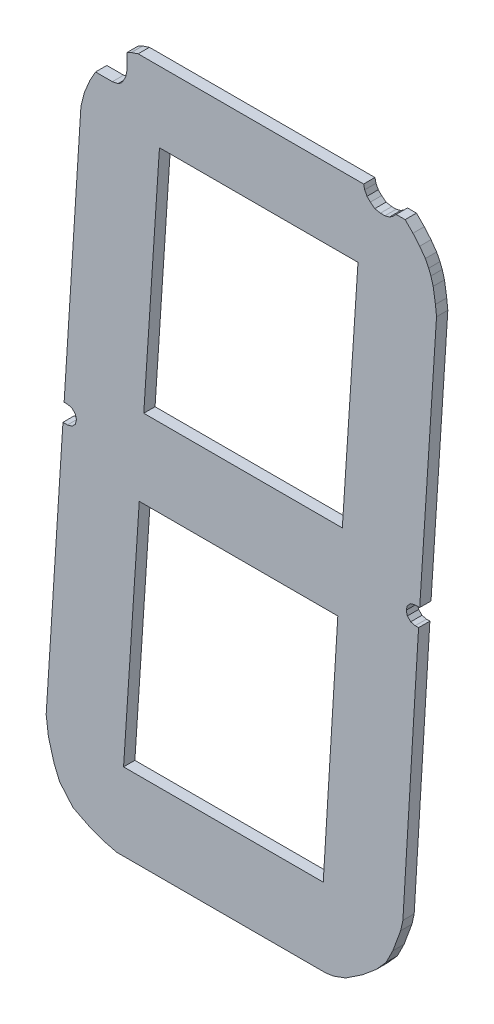
from build123d import *

# Parameters (mm, degrees)
AUFSATZ_LINEAR_AUSTRAGEN1_DEPTH = 1.6


with BuildPart() as part:
    # Skizze1 → Aufsatz-Linear austragen1 (new body)
    with BuildSketch(Plane.XY):
        Polygon((17.145, -47.307483333), (19.05, -45.720016667), (20.478733333, -44.132516667), (21.431266667, -42.227516667), (22.5425, -39.21125), (22.86, -37.782483333), (25.0825, -0.79375), (24.60625, -0.79375), (23.97125, -0.635), (23.495, -0.15875), (23.33625, 0.47625), (23.495, 1.11125), (23.97125, 1.5875), (24.60625, 1.74625), (25.24125, 1.74625), (27.6225, 38.57625), (27.463733333, 40.004983333), (27.146266667, 42.06875), (26.828733333, 43.180016667), (26.511266667, 43.97375), (26.035, 44.92625), (25.241266667, 46.037516667), (24.288766667, 47.14875), (23.1775, 48.259983333), (21.9075, 48.259983333), (21.431266667, 47.78375), (20.955, 47.46625), (20.32, 47.307516667), (19.685, 47.307516667), (18.891266667, 47.46625), (18.256266667, 47.942516667), (17.78, 48.41875), (17.4625, 49.05375), (17.303733333, 49.68875), (12.7, 49.68875), (-14.605, 49.68875), (-15.5575, 49.37125), (-16.1925, 49.05375), (-16.1925, 46.83125), (-16.351266667, 46.037516667), (-16.668733333, 45.402516667), (-16.986266667, 44.92625), (-17.4625, 44.60875), (-18.256266667, 44.450016667), (-20.6375, 44.450016667), (-21.431266667, 43.02125), (-22.225, 41.11625), (-22.701266667, 39.21125), (-25.0825, 1.74625), (-24.606266667, 1.74625), (-23.971266667, 1.587516667), (-23.495, 1.11125), (-23.336266667, 0.47625), (-23.495, -0.15875), (-23.971266667, -0.635016667), (-24.606266667, -0.79375), (-25.247066667, -0.793383333), (-27.6225, -37.782483333), (-27.305, -40.322483333), (-26.511266667, -43.180016667), (-25.7175, -45.085016667), (-23.8125, -47.307483333), (-21.59, -48.41875), (-19.526266667, -49.212483333), (-17.621266667, -49.68875), (11.906266667, -49.68875), (13.0175, -49.530016667), (14.763733333, -48.895016667), align=None)
        Polygon((13.6525, -5.080016667), (-14.446266667, -5.080016667), (-16.668733333, -38.735016667), (11.588733333, -38.735016667), align=None, mode=Mode.SUBTRACT)
        Polygon((-13.811266667, 6.032516667), (-11.588733333, 39.687516667), (16.51, 39.687516667), (14.2875, 6.032516667), align=None, mode=Mode.SUBTRACT)
    extrude(amount=AUFSATZ_LINEAR_AUSTRAGEN1_DEPTH)


solid = part.part
